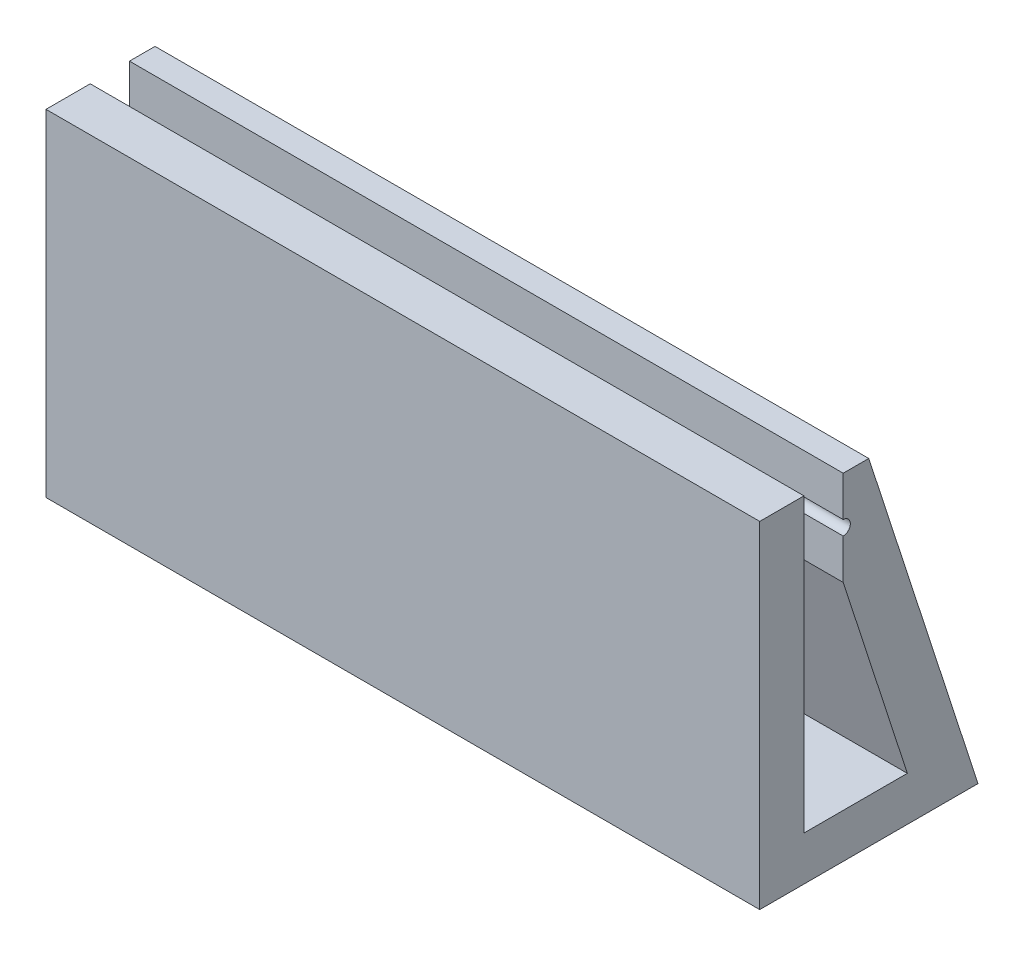
from build123d import *

# Parameters (mm, degrees)
BOSS_EXTRUDE1_DEPTH = 10


with BuildPart() as part:
    # Sketch1 → Boss-Extrude1 (new, symmetric)
    with BuildSketch(Plane(origin=(0, 0, 0), x_dir=(0, 0, -1), z_dir=(1, 0, 0))):
        with BuildLine():
            Line((0, 0), (6.116419195, 0))
            Line((6.116419195, 0), (3.055144814, 9.421633765))
            Line((3.055144814, 9.421633765), (2.339181313, 9.421633765))
            Line((2.339181313, 9.421633765), (2.339181313, 8.296337322))
            ThreePointArc((2.339181313, 8.296337322), (2.539181313, 8.096337322), (2.339181313, 7.896337322))
            Line((2.339181313, 7.896337322), (2.339181313, 6.771040879))
            Line((2.339181313, 6.771040879), (4.136591443, 1.239181313))
            Line((4.136591443, 1.239181313), (1.239181313, 1.239181313))
            Line((1.239181313, 1.239181313), (1.239181313, 9.421633765))
            Line((1.239181313, 9.421633765), (0, 9.421633765))
            Line((0, 9.421633765), (0, 0))
        make_face()
    extrude(amount=BOSS_EXTRUDE1_DEPTH, both=True)


solid = part.part
